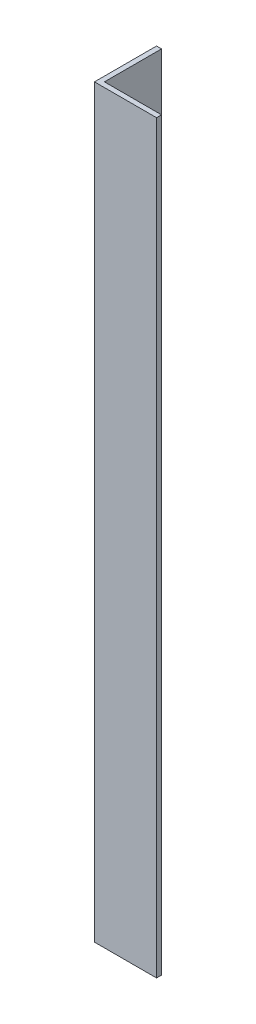
from build123d import *

# Parameters (mm, degrees)
EXTRUDE_1_DEPTH = 600


with BuildPart() as part:
    # Эскиз2 → Бобышка-Вытянуть1 (new body)
    with BuildSketch(Plane(origin=(0, 0, 0), x_dir=(1, 0, 0), z_dir=(0, 1, 0))):
        Polygon((0, 46), (0, 0), (46, 0), (46, -4), (-4, -4), (-4, 46), align=None)
    extrude(amount=EXTRUDE_1_DEPTH)


solid = part.part
